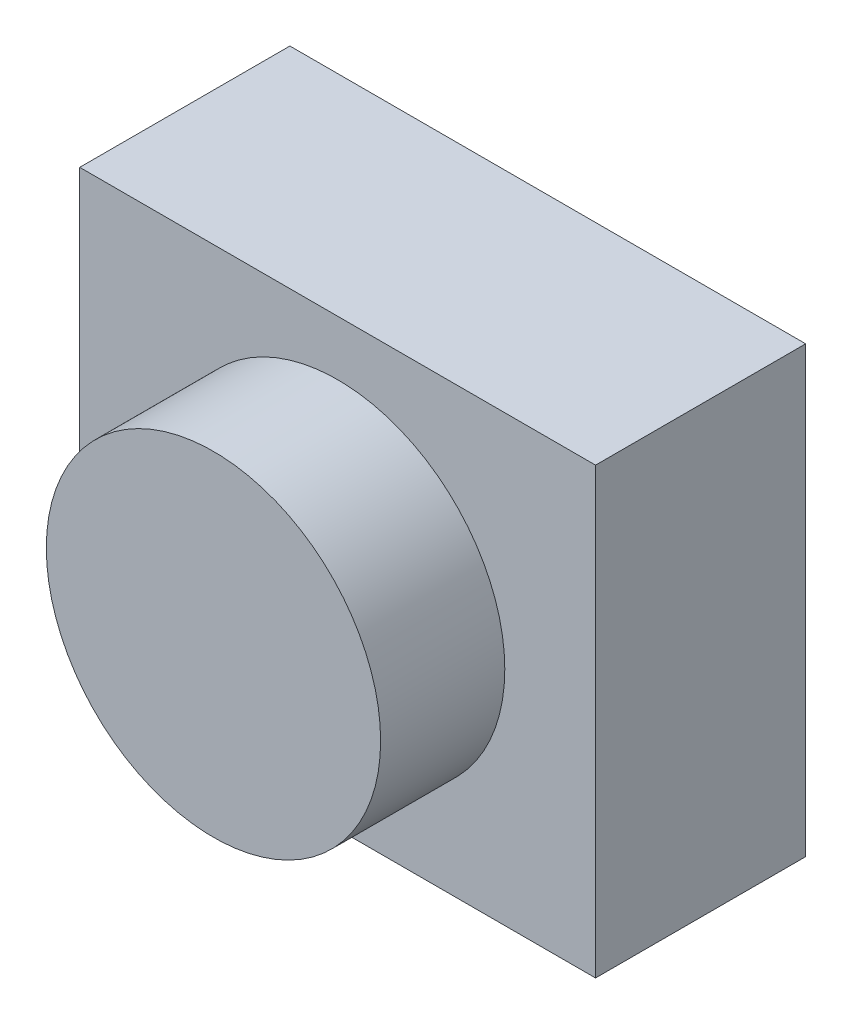
from build123d import *

# Parameters (mm, degrees)
ESQUISSE1_W        = 54
ESQUISSE1_H        = 46.5
BOSS_EXTRU_1_DEPTH = 22
ESQUISSE2_R        = 17.5
BOSS_EXTRU_2_DEPTH = 13


with BuildPart() as part:
    # Esquisse1 → Boss.-Extru.1 (new body)
    with BuildSketch(Plane.XY):
        Rectangle(ESQUISSE1_W, ESQUISSE1_H)
    extrude(amount=BOSS_EXTRU_1_DEPTH)

    # Esquisse2 → Boss.-Extru.2 (add)
    with BuildSketch(Plane.XY.offset(22)):
        with Locations(Location((0, 0, 0), (0, 0, 180))):
            Circle(ESQUISSE2_R)
    extrude(amount=BOSS_EXTRU_2_DEPTH)


solid = part.part
